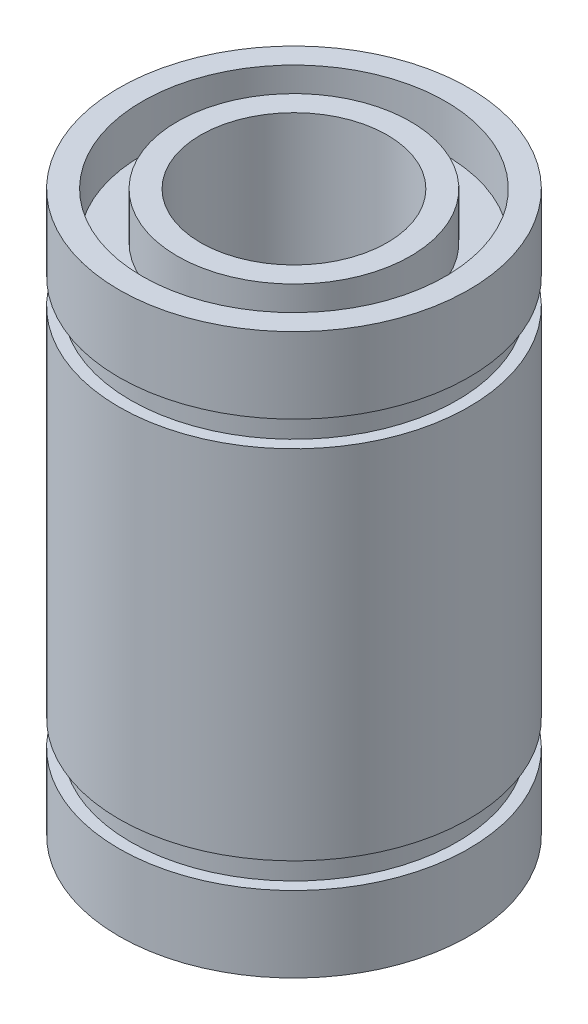
from build123d import *

# Parameters (mm, degrees)
SKETCH_1_R          = 7500
SKETCH_1_R_2        = 6500
EXTRUDE_1_DEPTH     = 12000
SKETCH_1_5_R        = 5000
SKETCH_1_5_R_2      = 4000
EXTRUDE_3_DEPTH     = 12000
SKETCH_1_6_R        = 6500
SKETCH_1_6_R_2      = 5000
EXTRUDE_4_DEPTH     = 10000
CUT_EXTRUDE_START   = 1100
SKETCH_3_R          = 7500
SKETCH_3_R_2        = 7000
CUT_EXTRUDE_1_DEPTH = 1100
SKETCH_4_R          = 7500
SKETCH_4_R_2        = 7000
CUT_EXTRUDE_2_DEPTH = 1100


with BuildPart() as part:
    # 草圖1 → 填料-伸長1 (new, symmetric)
    with BuildSketch(Plane(origin=(0, 0, 0), x_dir=(1, 0, 0), z_dir=(0, 1, 0))):
        Circle(SKETCH_1_R)
        Circle(SKETCH_1_R_2, mode=Mode.SUBTRACT)
    extrude(amount=EXTRUDE_1_DEPTH, both=True)



with BuildPart() as body_2:
    # 草圖1<5> → 填料-伸長3 (new, symmetric)
    with BuildSketch(Plane(origin=(0, 0, 0), x_dir=(1, 0, 0), z_dir=(0, 1, 0))):
        Circle(SKETCH_1_5_R)
        Circle(SKETCH_1_5_R_2, mode=Mode.SUBTRACT)
    extrude(amount=EXTRUDE_3_DEPTH, both=True)


with BuildPart() as part_1:
    add(part.part)

    add(body_2.part)  # 填料-伸長4 merges body 2
    # 草圖1<6> → 填料-伸長4 (add, symmetric)
    with BuildSketch(Plane(origin=(0, 0, 0), x_dir=(1, 0, 0), z_dir=(0, 1, 0))):
        Circle(SKETCH_1_6_R)
        Circle(SKETCH_1_6_R_2, mode=Mode.SUBTRACT)
    extrude(amount=EXTRUDE_4_DEPTH, both=True)

    # 草圖3 → 除料-伸長1 (cut)
    with BuildSketch(Plane(origin=(0, 7650, 0), x_dir=(1, 0, 0), z_dir=(0, 1, 0)).offset(CUT_EXTRUDE_START)):
        Circle(SKETCH_3_R)
        Circle(SKETCH_3_R_2, mode=Mode.SUBTRACT)
    extrude(amount=-CUT_EXTRUDE_1_DEPTH, mode=Mode.SUBTRACT)

    # 草圖4 → 除料-伸長2 (cut)
    with BuildSketch(Plane(origin=(0, -7650, 0), x_dir=(1, 0, 0), z_dir=(0, 1, 0))):
        Circle(SKETCH_4_R)
        Circle(SKETCH_4_R_2, mode=Mode.SUBTRACT)
    extrude(amount=-CUT_EXTRUDE_2_DEPTH, mode=Mode.SUBTRACT)


solid = part_1.part
